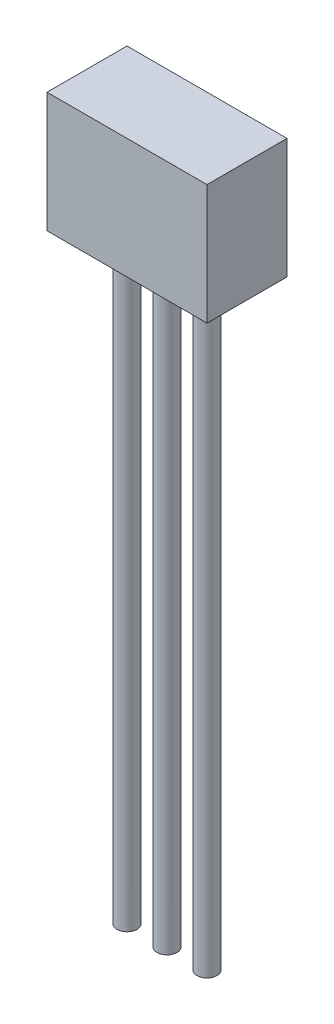
from build123d import *

# Parameters (mm, degrees)
HEAD_DEPTH = 3
SKETCH3_R  = 0.25
PINS_DEPTH = 15


with BuildPart() as part:
    # Sketch2 → Head (new body)
    with BuildSketch(Plane(origin=(0, 0, 0), x_dir=(1, 0, 0), z_dir=(0, 1, 0))):
        Polygon((-2, 0), (-2, 1), (2, 1), (2, 0), (2, -1), (-2, -1), align=None)
    extrude(amount=HEAD_DEPTH)

    # Sketch3 → Pins (add)
    with BuildSketch(Plane(origin=(0, 0, 0), x_dir=(1, 0, 0), z_dir=(0, 1, 0))):
        with Locations(Location((0, 0, 0), (0, 0, 270))):
            Circle(SKETCH3_R)
        with Locations(Location((-1, 0, 0), (0, 0, 270))):
            Circle(SKETCH3_R)
        with Locations(Location((1, 0, 0), (0, 0, 270))):
            Circle(SKETCH3_R)
    extrude(amount=-PINS_DEPTH)


solid = part.part
